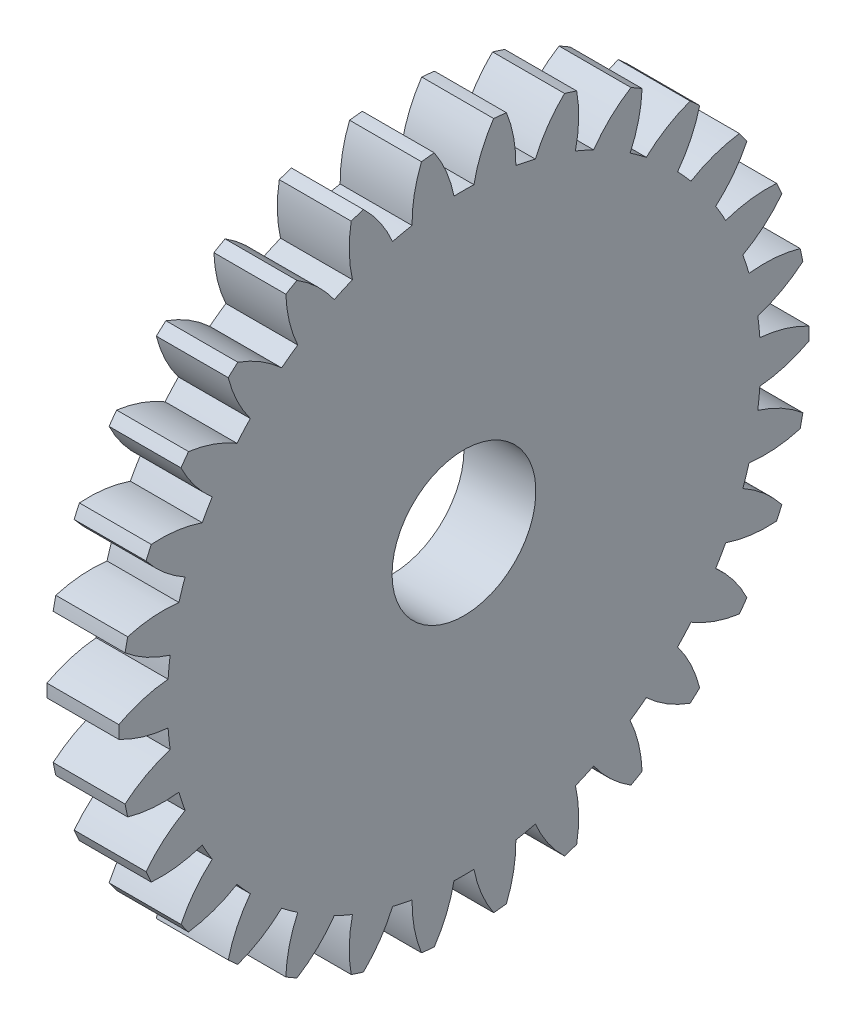
from build123d import *

# Parameters (mm, degrees)
BASPROSKE_W     = 5
BASPROSKE_H     = 24
TOOTHCUT_DEPTH  = 35.307433597
TEETHCUTS_COUNT = 30
TEETHCUTS_ANGLE = 348
BORSKE_R        = 5
BORE_DEPTH      = 50.0000508


with BuildPart() as part:
    # BasProSke → Base-Revolve (revolve)
    with BuildSketch(Plane(origin=(0, 0, 0), x_dir=(1, 0, 0), z_dir=(0, 1, 0)), mode=Mode.PRIVATE) as base_revolve_sk:
        with Locations((2.5, 12)):
            Rectangle(BASPROSKE_W, BASPROSKE_H)
    revolve(base_revolve_sk.sketch.rotate(Axis((-10, 0, 0), (1, 0, 0)), 180), axis=Axis((-10, 0, 0), (1, 0, 0)))

    # TooCutSke → ToothCut (cut, through all)
    with BuildSketch(Plane(origin=(0, 0, 0), x_dir=(0, 0, -1), z_dir=(1, 0, 0))):
        with BuildLine():
            ThreePointArc((0.693278797, 20.612344372), (0, 20.624), (-0.693278797, 20.612344372))
            ThreePointArc((-0.693278797, 20.612344372), (-1.219042225, 22.34383125), (-2.080549663, 23.935144835))
            ThreePointArc((-2.080549663, 23.935144835), (0, 24.0254), (2.080549663, 23.935144835))
            ThreePointArc((2.080549663, 23.935144835), (1.219042225, 22.34383125), (0.693278797, 20.612344372))
        make_face()
    toothcut = extrude(amount=TOOTHCUT_DEPTH, mode=Mode.SUBTRACT)

    # TeethCuts: ToothCut ×30 about axis
    teethcuts_axis = Axis((-10, 0, 0), (1, 0, 0))
    for i in range(1, TEETHCUTS_COUNT):
        add(toothcut.rotate(teethcuts_axis, i * TEETHCUTS_ANGLE / (TEETHCUTS_COUNT - 1)), mode=Mode.SUBTRACT)

    # BorSke → Bore (cut, symmetric)
    with BuildSketch(Plane(origin=(0, 0, 0), x_dir=(0, 0, -1), z_dir=(1, 0, 0))):
        with Locations(Location((0, 0, 0), (0, 0, 180))):
            Circle(BORSKE_R)
    extrude(amount=BORE_DEPTH, both=True, mode=Mode.SUBTRACT)


solid = part.part
